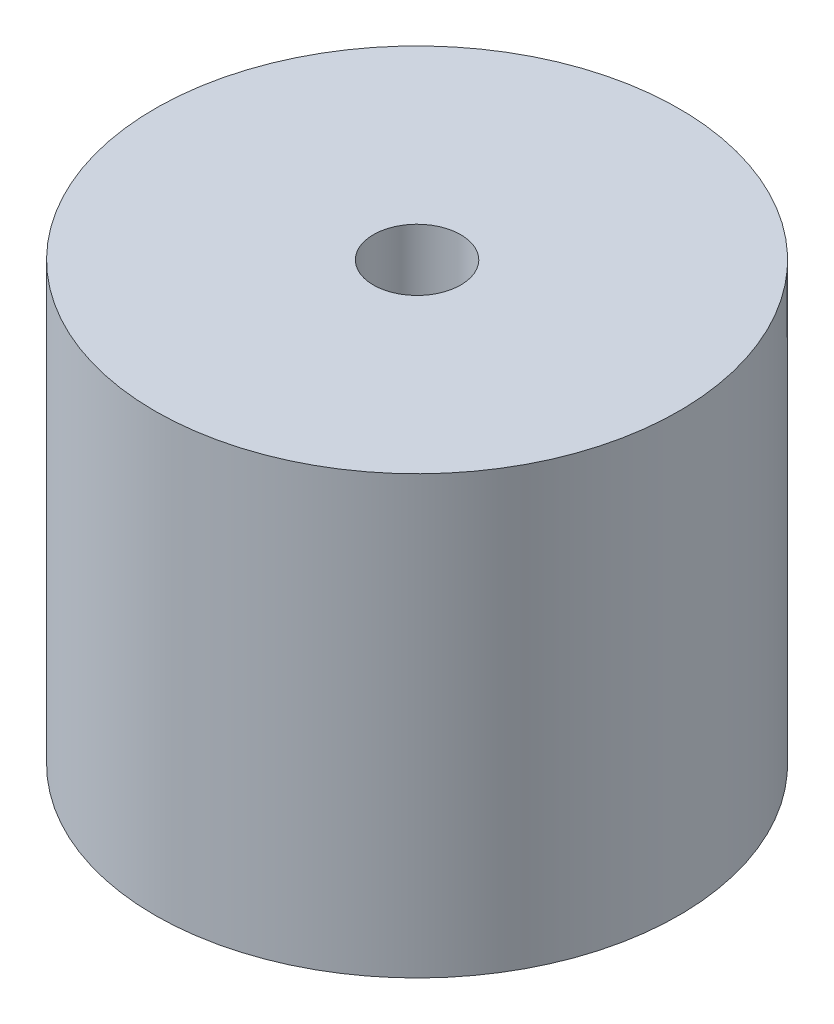
from build123d import *

# Parameters (mm, degrees)
SKETCH1_R           = 18
BOSS_EXTRUDE1_DEPTH = 30
SKETCH2_R           = 3
CUT_EXTRUDE1_DEPTH  = 42.5


with BuildPart() as part:
    # Sketch1 → Boss-Extrude1 (new body)
    with BuildSketch(Plane(origin=(0, 0, 0), x_dir=(1, 0, 0), z_dir=(0, 1, 0))):
        with Locations(Location((0, 0, 0), (0, 0, 270))):
            Circle(SKETCH1_R)
    extrude(amount=BOSS_EXTRUDE1_DEPTH)

    # Sketch2 → Cut-Extrude1 (cut, symmetric)
    with BuildSketch(Plane(origin=(0, 30, 0), x_dir=(1, 0, 0), z_dir=(0, 1, 0))):
        with Locations(Location((0, 0, 0), (0, 0, 270))):
            Circle(SKETCH2_R)
    extrude(amount=CUT_EXTRUDE1_DEPTH, both=True, mode=Mode.SUBTRACT)


solid = part.part
